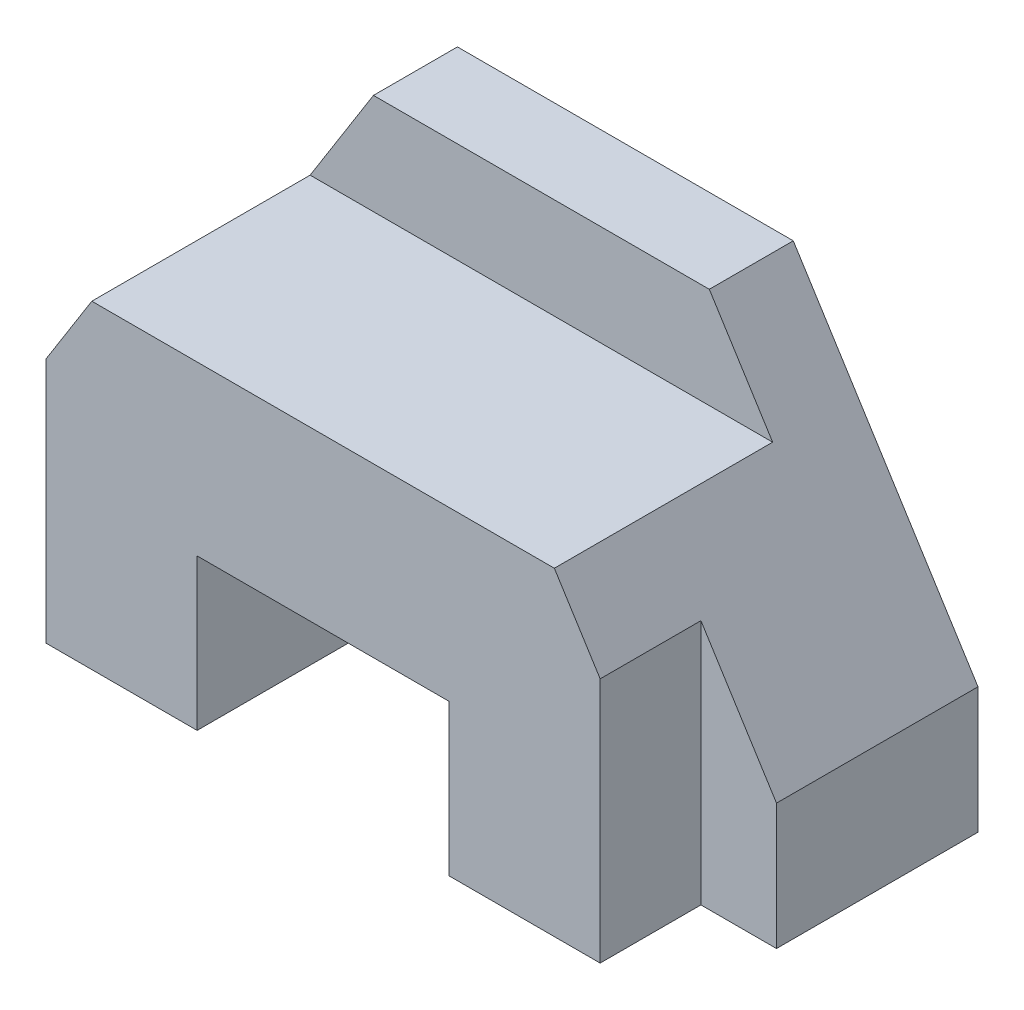
from build123d import *

# Parameters (mm, degrees)
SALIENTE_EXTRUIR1_DEPTH = 18
CORTAR_EXTRUIR1_DEPTH   = 26
CORTAR_EXTRUIR2_DEPTH   = 12
CROQUIS4_W              = 30
CROQUIS4_H              = 18
CORTAR_EXTRUIR3_DEPTH   = 75.565407529


with BuildPart() as part:
    # Croquis1 → Saliente-Extruir1 (new, symmetric)
    with BuildSketch(Plane.XY):
        Polygon((42, 0), (-42, 0), (-42, 15), (-20, 50), (20, 50), (42, 15), align=None)
    extrude(amount=SALIENTE_EXTRUIR1_DEPTH, both=True)

    # Croquis2 → Cortar-Extruir1 (cut)
    with BuildSketch(Plane.XY.offset(18)):
        Polygon((-27.542857143, 38), (27.542857143, 38), (20, 50), (-20, 50), align=None)
    extrude(amount=-CORTAR_EXTRUIR1_DEPTH, mode=Mode.SUBTRACT)

    # Croquis3 → Cortar-Extruir2 (cut)
    with BuildSketch(Plane.XY.offset(18)):
        Polygon((-33, 0), (-33, 29.318181818), (-42, 15), (-42, 0), align=None)
        Polygon((33, 29.318181818), (33, 0), (42, 0), (42, 15), align=None)
    extrude(amount=-CORTAR_EXTRUIR2_DEPTH, mode=Mode.SUBTRACT)

    # Croquis4 → Cortar-Extruir3 (cut, through all)
    with BuildSketch(Plane.XY.offset(18)):
        with Locations((0, 9)):
            Rectangle(CROQUIS4_W, CROQUIS4_H)
    extrude(amount=-CORTAR_EXTRUIR3_DEPTH, mode=Mode.SUBTRACT)


solid = part.part
